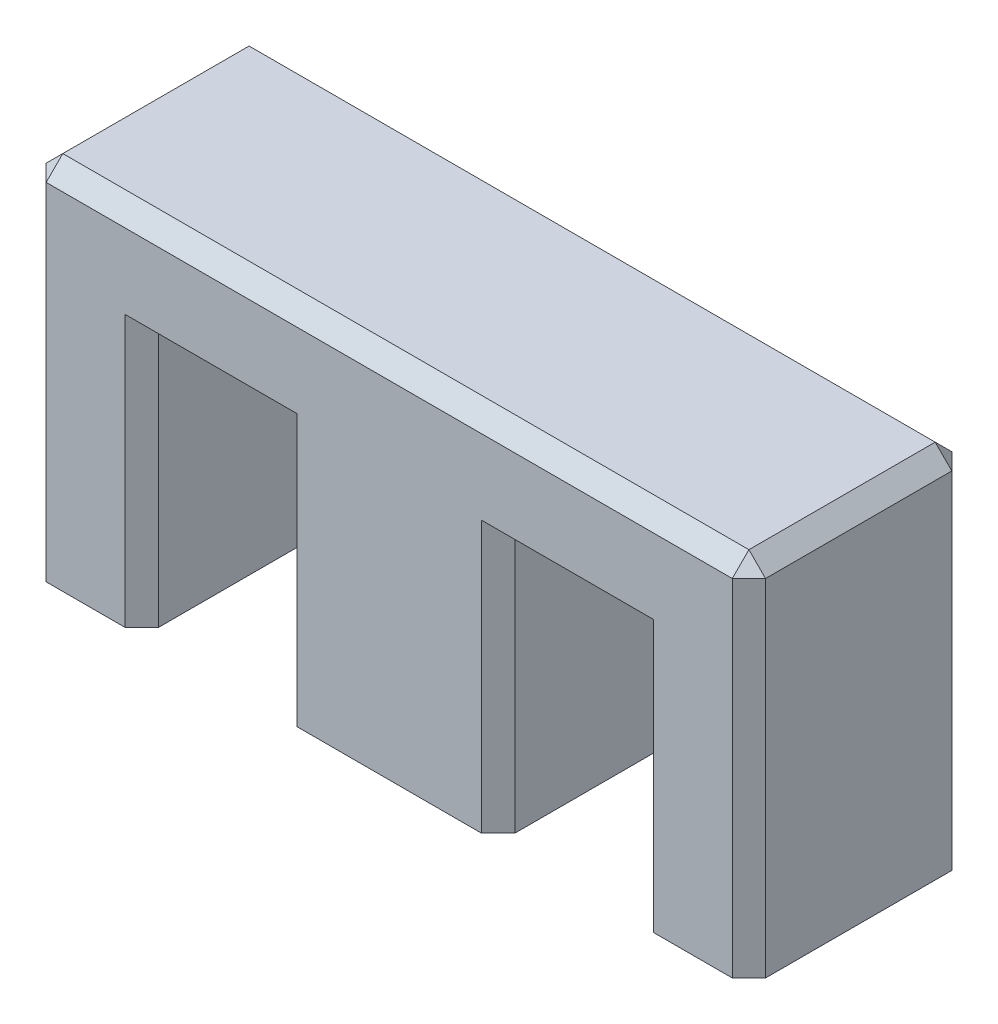
from build123d import *

# Parameters (mm, degrees)
BOSS_EXTRUDE1_DEPTH = 13.2
CHAMFER1_SIZE       = 2


with BuildPart() as part:
    # Sketch1 → Boss-Extrude1 (new, symmetric)
    with BuildSketch(Plane.XY):
        Polygon((43.25, 31.173529412), (-43.25, 31.173529412), (-43.25, -12.426470588), (-29.75, -12.426470588), (-29.75, 18.173529412), (-13.1, 18.173529412), (-13.1, -12.426470588), (13.1, -12.426470588), (13.1, 18.173529412), (29.75, 18.173529412), (29.75, -12.426470588), (43.25, -12.426470588), align=None)
    extrude(amount=BOSS_EXTRUDE1_DEPTH, both=True)

    # Chamfer1
    chamfer1_edges = [part.edges().sort_by_distance(p)[0] for p in [
        (13.1, 2.873529412, -13.2),
        (-13.1, 2.873529412, -13.2),
        (-21.425, 18.173529412, -13.2),
        (-29.75, 2.873529412, -13.2),
        (-43.25, 9.373529412, -13.2),
        (0, 31.173529412, -13.2),
        (43.25, 9.373529412, -13.2),
        (29.75, 2.873529412, -13.2),
        (21.425, 18.173529412, -13.2),
        (43.25, 9.373529412, 13.2),
        (0, 31.173529412, 13.2),
        (-43.25, 31.173529412, 0),
        (43.25, 31.173529412, 0),
        (-43.25, 9.373529412, 13.2),
        (-29.75, 2.873529412, 13.2),
        (-21.425, 18.173529412, 13.2),
        (-13.1, 2.873529412, 13.2),
        (13.1, 2.873529412, 13.2),
        (21.425, 18.173529412, 13.2),
        (29.75, 2.873529412, 13.2),
    ]]
    chamfer(chamfer1_edges, length=CHAMFER1_SIZE)


solid = part.part
